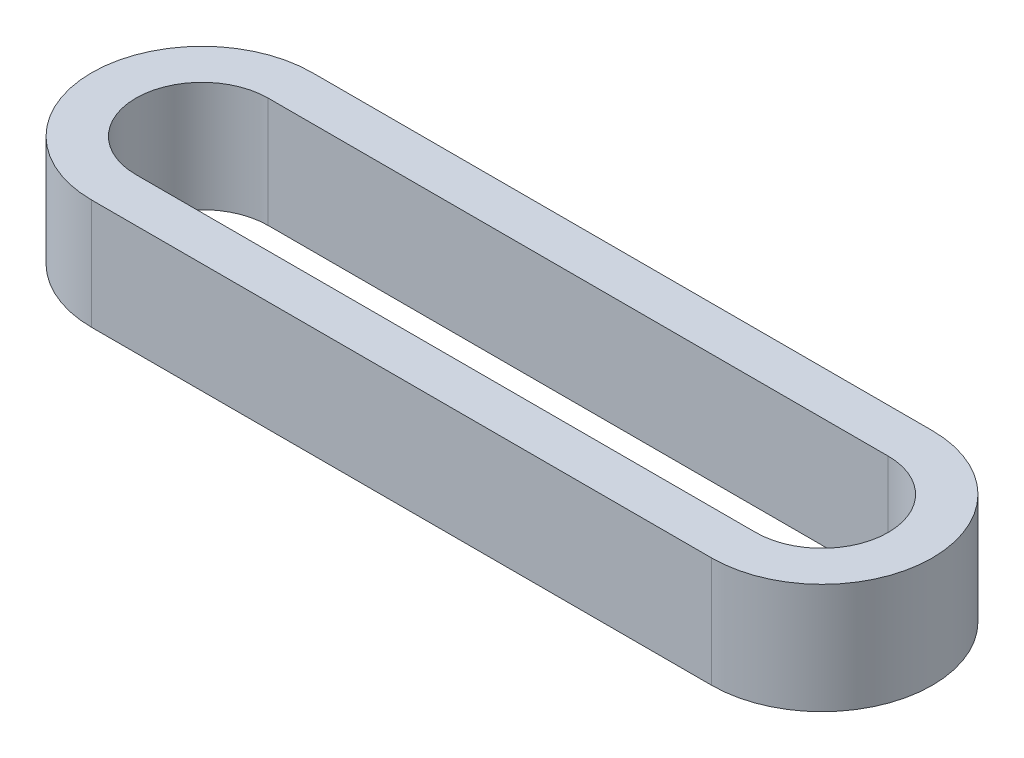
from build123d import *

# Parameters (mm, degrees)
EXTRUDE_THIN1_DEPTH = 2.5


with BuildPart() as part:
    # Sketch1 → Extrude-Thin1 (new body)
    with BuildSketch(Plane(origin=(0, 0, 0), x_dir=(1, 0, 0), z_dir=(0, 1, 0))):
        with BuildLine():
            Line((7.025, -2.5), (-7.025, -2.5))
            ThreePointArc((-7.025, -2.5), (-9.525, 0), (-7.025, 2.5))
            Line((-7.025, 2.5), (7.025, 2.5))
            ThreePointArc((7.025, 2.5), (9.525, 0), (7.025, -2.5))
        make_face()
        with BuildLine():
            Line((7.025, -1.5), (-7.025, -1.5))
            ThreePointArc((-7.025, -1.5), (-8.525, 0), (-7.025, 1.5))
            Line((-7.025, 1.5), (7.025, 1.5))
            ThreePointArc((7.025, 1.5), (8.525, 0), (7.025, -1.5))
        make_face(mode=Mode.SUBTRACT)
    extrude(amount=EXTRUDE_THIN1_DEPTH)


solid = part.part
